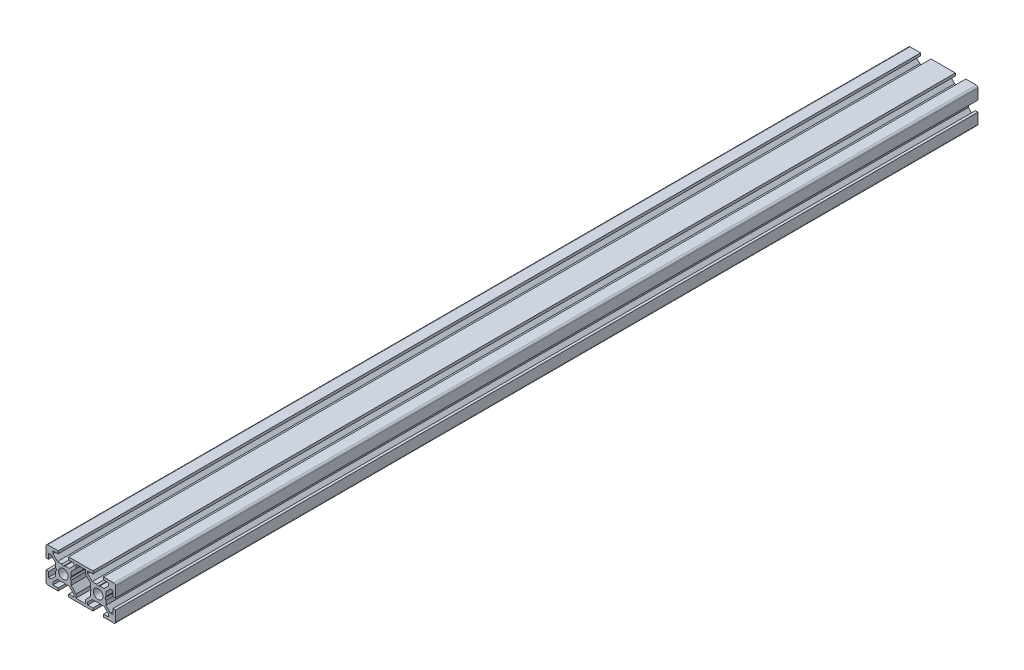
from build123d import *

# Parameters (mm, degrees)
SKETCH1_R           = 2.75
BOSS_EXTRUDE1_DEPTH = 496
FILLET2_R           = 1
FILLET4_R           = 1
FILLET5_R           = 1
FILLET6_R           = 1


with BuildPart() as part:
    # Sketch1 → Boss-Extrude1 (new body)
    with BuildSketch(Plane.XY):
        Polygon((-3.001792446, 10), (-10, 10), (-10, 3.001792446), (-8.500771543, 3.001792446), (-8.500771543, 6.014407427), (-7.045753692, 6.014407427), (-4.458187435, 3.426841169), (-4.458187435, 0.939646666), (-3.934715846, 0), (-4.45749106, -0.939646666), (-4.458187435, -3.426841169), (-7.045753692, -6.014407427), (-8.500771543, -6.014407427), (-8.500771543, -3.001792446), (-10, -3.001792446), (-10, -10), (-3.001792446, -10), (-3.001792446, -8.499999951), (-6.014791508, -8.499999951), (-6.014791508, -7.045753643), (-3.427225251, -4.458187385), (-0.939604714, -4.458187385), (-0.00108721, -3.933944043), (0.937618184, -4.457850876), (3.425238721, -4.457850876), (6.012804978, -7.045417133), (6.012804978, -8.500000007), (3.001792545, -8.500000007), (3.001792545, -10), (16.998207455, -10), (16.998207455, -8.500000007), (13.987195022, -8.500000007), (13.987195022, -7.045417133), (16.574761279, -4.457850876), (19.062381816, -4.457850876), (20.00108721, -3.933944043), (20.939604714, -4.458187385), (23.427225251, -4.458187385), (26.014791508, -7.045753643), (26.014791508, -8.499999951), (23.001792446, -8.499999951), (23.001792446, -10), (30, -10), (30, -3.001792446), (28.500771543, -3.001792446), (28.500771543, -6.014407427), (27.045753692, -6.014407427), (24.458187435, -3.426841169), (24.45749106, -0.939646666), (23.934715846, 0), (24.458187435, 0.939646666), (24.458187435, 3.426841169), (27.045753692, 6.014407427), (28.500771543, 6.014407427), (28.500771543, 3.001792446), (30, 3.001792446), (30, 10), (23.001792446, 10), (23.001792446, 8.499999951), (26.014791508, 8.499999951), (26.014791508, 7.045753643), (23.427225251, 4.458187385), (20.939604714, 4.458187385), (20.00108721, 3.933944043), (19.062381816, 4.457850876), (16.574761279, 4.457850876), (13.987195022, 7.045417133), (13.987195022, 8.499999951), (16.998207356, 8.499999951), (16.998207356, 10), (3.001792643, 10), (3.001792643, 8.499999951), (6.012804978, 8.499999951), (6.012804978, 7.045417133), (3.425238721, 4.457850876), (0.937618184, 4.457850876), (-0.00108721, 3.933944043), (-0.939604714, 4.458187385), (-3.427225251, 4.458187385), (-6.014791508, 7.045753643), (-6.014791508, 8.499999951), (-3.001792446, 8.499999951), align=None)
        Circle(SKETCH1_R, mode=Mode.SUBTRACT)
        with Locations(Location((20, 0, 0), (0, 0, 180))):
            Circle(SKETCH1_R, mode=Mode.SUBTRACT)
        Polygon((7.208733292, -6.419793455), (7.208733292, -8.500000007), (12.791266708, -8.500000007), (12.791266708, -6.419793455), (15.541654987, -3.426231961), (15.541209058, -0.938611464), (16.065284154, 0), (15.54250894, 0.939646666), (15.541655044, 3.426231961), (12.791266708, 6.17760654), (12.791266708, 8.499999951), (7.208733292, 8.499999951), (7.208733292, 6.17760654), (4.458344956, 3.426231961), (4.45749106, 0.939646666), (3.934715846, 0), (4.458790942, -0.938611464), (4.458345013, -3.426231961), align=None, mode=Mode.SUBTRACT)
    extrude(amount=BOSS_EXTRUDE1_DEPTH)

    # Fillet2
    fillet2_edges = [part.edges().sort_by_distance(p)[0] for p in [
        (-10, -10, 248),
    ]]
    fillet(fillet2_edges, radius=FILLET2_R)

    # Fillet4
    fillet4_edges = [part.edges().sort_by_distance(p)[0] for p in [
        (-10, 10, 248),
    ]]
    fillet(fillet4_edges, radius=FILLET4_R)

    # Fillet5
    fillet5_edges = [part.edges().sort_by_distance(p)[0] for p in [
        (30, 10, 248),
    ]]
    fillet(fillet5_edges, radius=FILLET5_R)

    # Fillet6
    fillet6_edges = [part.edges().sort_by_distance(p)[0] for p in [
        (30, -10, 248),
    ]]
    fillet(fillet6_edges, radius=FILLET6_R)


solid = part.part
